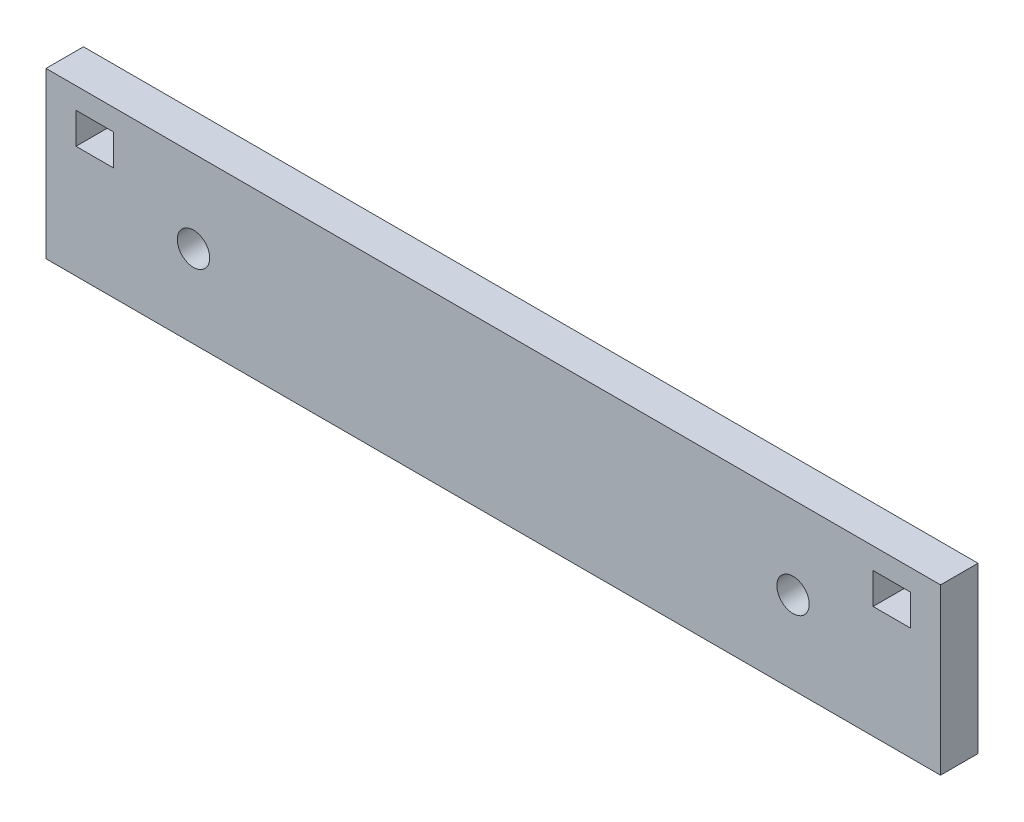
from build123d import *

# Parameters (mm, degrees)
SKETCH1_W           = 37.8968
SKETCH1_H           = 6.985
SKETCH1_R           = 0.6858
SKETCH1_W_2         = 1.5875
SKETCH1_H_2         = 1.3208
BOSS_EXTRUDE1_DEPTH = 1.5875


with BuildPart() as part:
    # Sketch1 → Boss-Extrude1 (new body)
    with BuildSketch(Plane.XY):
        Rectangle(SKETCH1_W, SKETCH1_H)
        with Locations((-12.7, 0)):
            Circle(SKETCH1_R, mode=Mode.SUBTRACT)
        with Locations(Location((12.7, 0, 0), (0, 0, 180))):
            Circle(SKETCH1_R, mode=Mode.SUBTRACT)
        with Locations((-16.88465, 1.9304)):
            Rectangle(SKETCH1_W_2, SKETCH1_H_2, mode=Mode.SUBTRACT)
        with Locations((16.88465, 1.9304)):
            Rectangle(SKETCH1_W_2, SKETCH1_H_2, mode=Mode.SUBTRACT)
    extrude(amount=BOSS_EXTRUDE1_DEPTH)


solid = part.part
